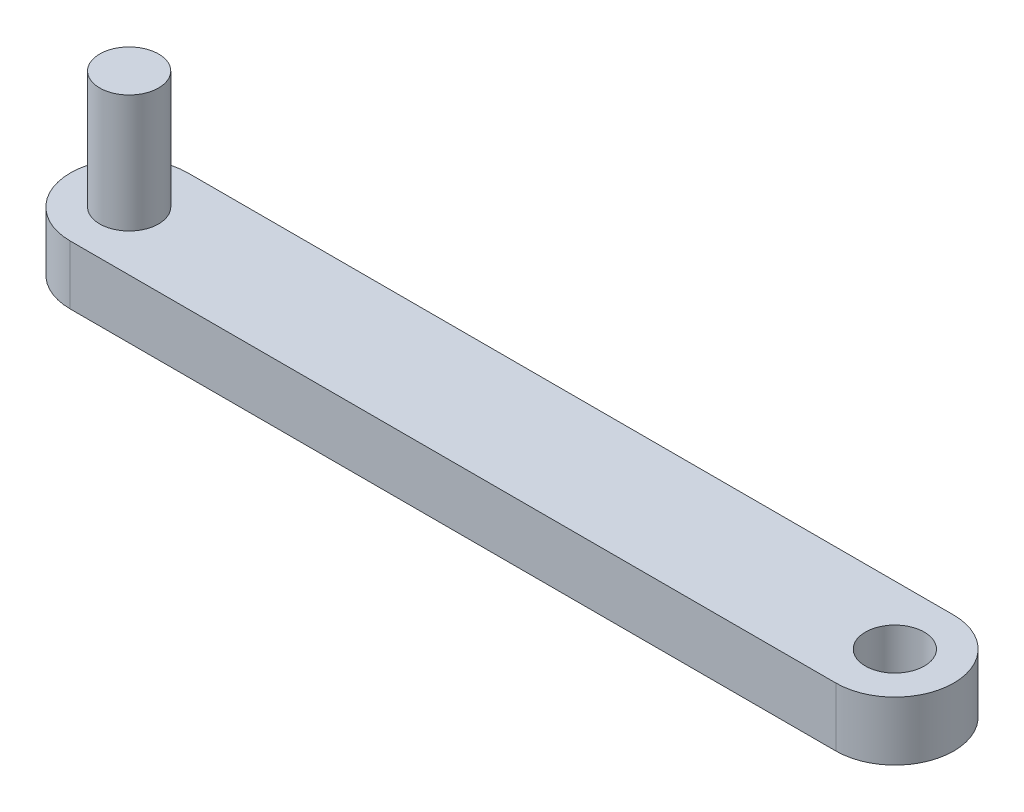
from build123d import *

# Parameters (mm, degrees)
SKETCH1_R                = 5
BOSS_EXTRUDE1_DEPTH      = 5
BOSS_EXTRUDE2_DEPTH      = 25
BOSS_EXTRUDE2_DEPTH_BACK = 5
SKETCH2_R                = 5


with BuildPart() as part:
    # Sketch1 → Boss-Extrude1 (new, symmetric)
    with BuildSketch(Plane(origin=(0, 0, 0), x_dir=(1, 0, 0), z_dir=(0, 1, 0))):
        with BuildLine():
            Line((-65, -10), (65, -10))
            ThreePointArc((65, -10), (75, 0), (65, 10))
            Line((65, 10), (-65, 10))
            ThreePointArc((-65, 10), (-75, 0), (-65, -10))
        make_face()
        with Locations(Location((-65, 0, 0), (0, 0, 270))):
            Circle(SKETCH1_R, mode=Mode.SUBTRACT)
        with Locations(Location((65, 0, 0), (0, 0, 270))):
            Circle(SKETCH1_R, mode=Mode.SUBTRACT)
    extrude(amount=BOSS_EXTRUDE1_DEPTH, both=True)

    # Sketch2 → Boss-Extrude2 (add, two sides: drawn at the far end of the back side and taken through both)
    with BuildSketch(Plane(origin=(0, 0, 0), x_dir=(1, 0, 0), z_dir=(0, 1, 0)).offset(-BOSS_EXTRUDE2_DEPTH_BACK)):
        with Locations(Location((-65, 0, 0), (0, 0, 270))):
            Circle(SKETCH2_R)
    extrude(amount=BOSS_EXTRUDE2_DEPTH + BOSS_EXTRUDE2_DEPTH_BACK)


solid = part.part
